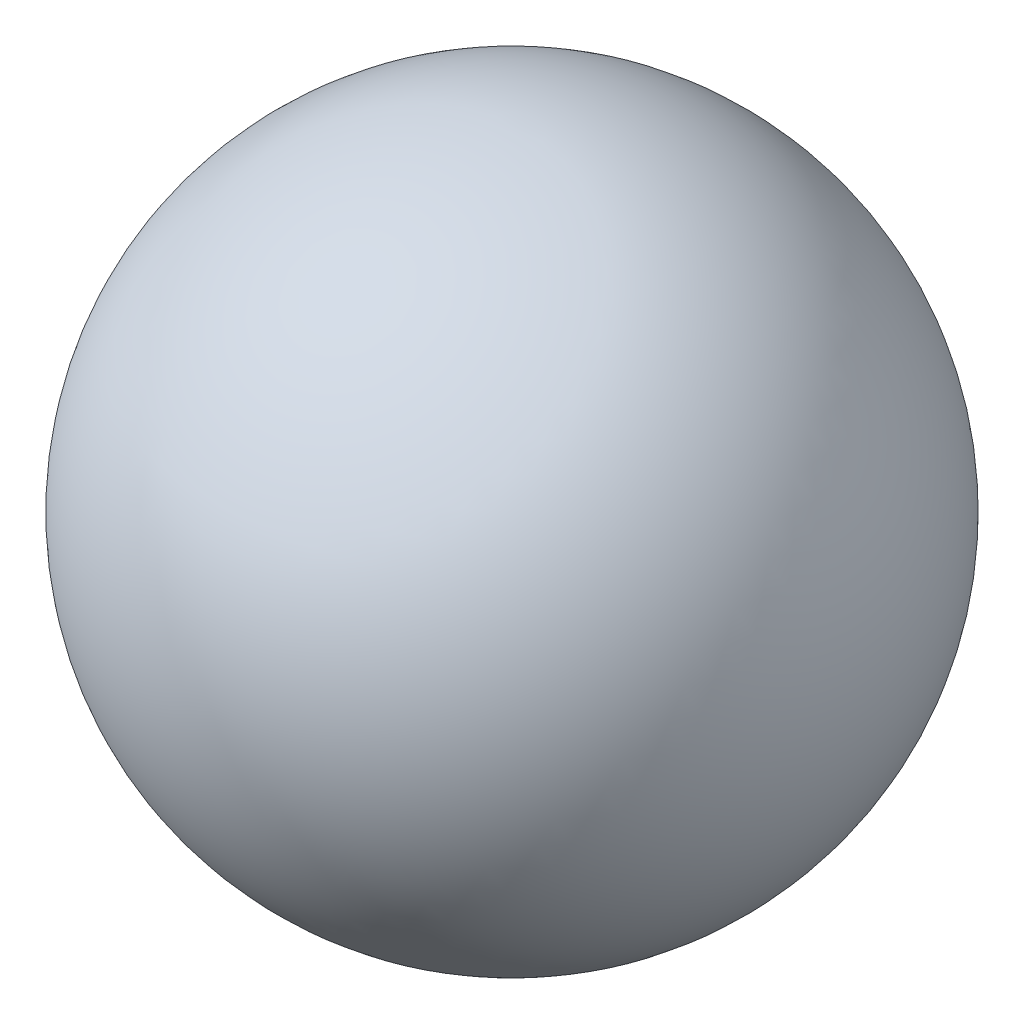
from build123d import *


with BuildPart() as part:
    # Sketch1 → Revolve3 (revolve)
    with BuildSketch(Plane.XY):
        with BuildLine():
            Line((0, 33.5), (0, -33.5))
            ThreePointArc((0, -33.5), (-33.5, 0), (0, 33.5))
        make_face()
    revolve(axis=Axis((0, -33.5, 0), (0, 1, 0)))


solid = part.part
